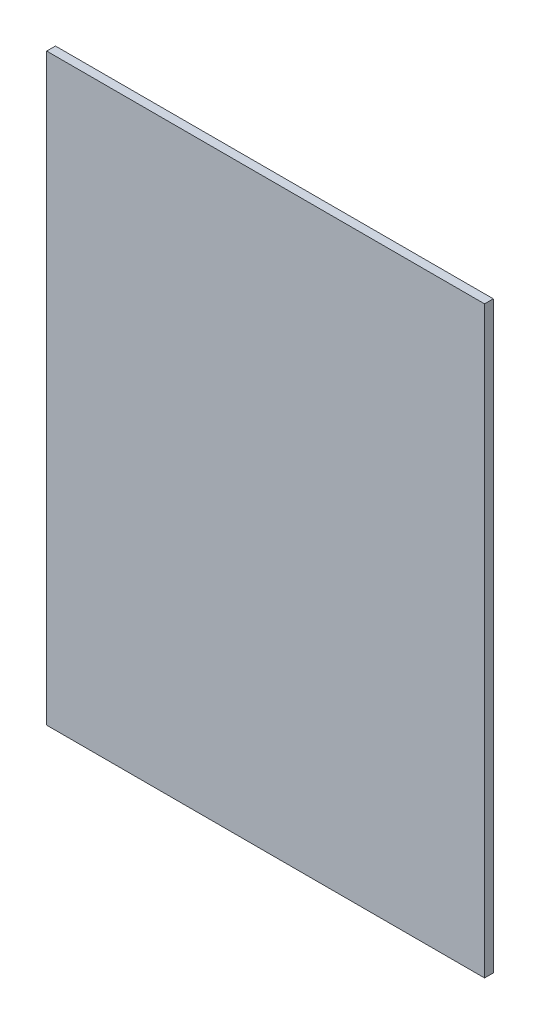
from build123d import *

# Parameters (mm, degrees)
ESBO_O1_W                = 150
ESBO_O1_H                = 200
RESSALTO_EXTRUS_O1_DEPTH = 3


with BuildPart() as part:
    # Esboço1 → Ressalto-extrusão1 (new body)
    with BuildSketch(Plane.XY):
        Rectangle(ESBO_O1_W, ESBO_O1_H)
    extrude(amount=RESSALTO_EXTRUS_O1_DEPTH)


solid = part.part
